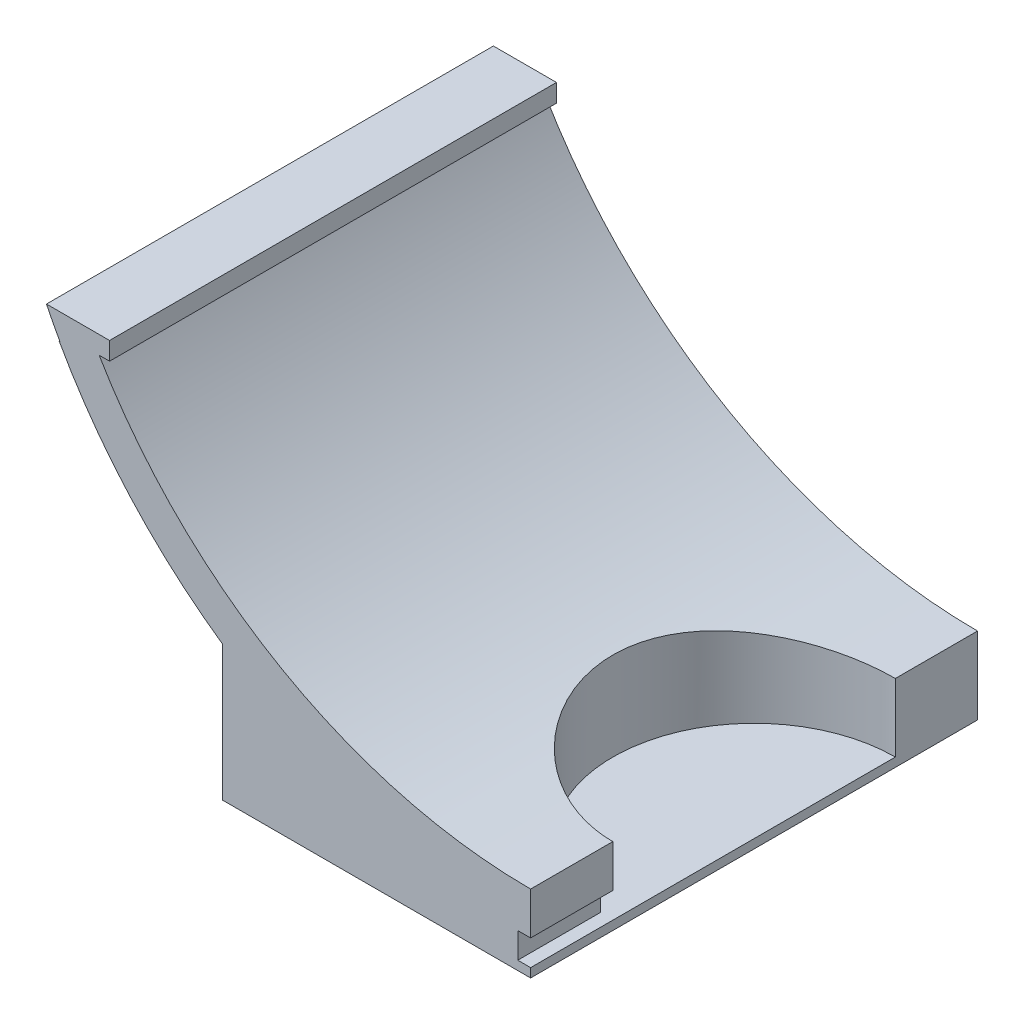
from build123d import *

# Parameters (mm, degrees)
SKETCH_1_R          = 210
SKETCH_1_R_2        = 203
EXTRUDE_2_DEPTH     = 174
EXTRUDE_START       = -174
EXTRUDE_4_DEPTH     = 174
CUT_EXTRUDE_1_DEPTH = 654
EXTRUDE_5_DEPTH     = 174
EXTRUDE_6_DEPTH     = 174
EXTRUDE_7_DEPTH     = 174
EXTRUDE_8_DEPTH     = 174
EXTRUDE_9_DEPTH     = 174
SKETCH_11_R         = 55
CUT_EXTRUDE_4_DEPTH = 221.5
CUT_EXTRUDE_5_DEPTH = 87
SKETCH_12_W         = 668.295244713
SKETCH_12_H         = 385.154580286
CUT_EXTRUDE_6_DEPTH = 280


with BuildPart() as part:
    # 草图1 → 凸台-拉伸2 (new body)
    with BuildSketch(Plane.XY):
        Circle(SKETCH_1_R)
        Circle(SKETCH_1_R_2, mode=Mode.SUBTRACT)
    extrude(amount=EXTRUDE_2_DEPTH)

    # 草图2 → 凸台-拉伸4 (add)
    with BuildSketch(Plane.XY.offset(174).offset(EXTRUDE_START)):
        with BuildLine():
            Line((-170.735431044, -102), (-173.735431044, -102))
            Line((-173.735431044, -102), (-175.513532242, -102))
            ThreePointArc((-175.513532242, -102), (-174.63092392, -103.50381834), (-173.735431044, -105))
            Line((-173.735431044, -105), (-170.735431044, -105))
            Line((-170.735431044, -105), (-170.735431044, -102))
        make_face()
        with BuildLine():
            ThreePointArc((173.735431044, -105), (174.63092392, -103.50381834), (175.513532242, -102))
            Line((175.513532242, -102), (173.735431044, -102))
            Line((173.735431044, -102), (170.735431044, -102))
            Line((170.735431044, -102), (170.735431044, -105))
            Line((170.735431044, -105), (173.735431044, -105))
        make_face()
    extrude(amount=EXTRUDE_4_DEPTH)

    # 草图3 → 切除-拉伸1 (cut)
    with BuildSketch(Plane.XY.offset(174)):
        Polygon((-170.735431044, -102), (238.333646515, -102), (254.334169784, 272.292523591), (-334.569415043, 221.85110305), (-306.830562533, -102), align=None)
    extrude(amount=-CUT_EXTRUDE_1_DEPTH, mode=Mode.SUBTRACT)

    # 草图5 → 凸台-拉伸5 (add)
    with BuildSketch(Plane.XY.offset(174).offset(EXTRUDE_START)):
        with BuildLine():
            Line((-120, -209.75), (-10.243900624, -209.75))
            ThreePointArc((-10.243900624, -209.75), (-67.755470707, -198.769203322), (-120, -172.336879396))
            Line((-120, -172.336879396), (-120, -209.75))
        make_face()
        with BuildLine():
            ThreePointArc((120, -172.336879396), (67.755470707, -198.769203322), (10.243900624, -209.75))
            Line((10.243900624, -209.75), (120, -209.75))
            Line((120, -209.75), (120, -172.336879396))
        make_face()
    extrude(amount=EXTRUDE_5_DEPTH)

    # 草图6 → 凸台-拉伸6 (add)
    with BuildSketch(Plane.XY.offset(174).offset(EXTRUDE_START)):
        with BuildLine():
            Line((-175.513532242, -102), (-166.195667814, -102))
            ThreePointArc((-166.195667814, -102), (0, -195), (166.195667814, -102))
            Line((166.195667814, -102), (175.513532242, -102))
            ThreePointArc((175.513532242, -102), (0, -203), (-175.513532242, -102))
        make_face()
    extrude(amount=EXTRUDE_6_DEPTH)

    # 草图7 → 凸台-拉伸7 (add)
    with BuildSketch(Plane.XY.offset(174).offset(EXTRUDE_START)):
        with BuildLine():
            Line((-166.933126535, -92), (-166.933126535, -95))
            Line((-166.933126535, -95), (-170.293863659, -95))
            ThreePointArc((-170.293863659, -95), (0, -195), (170.293863659, -95))
            Line((170.293863659, -95), (166.933126535, -95))
            Line((166.933126535, -95), (166.933126535, -92))
            Line((166.933126535, -92), (171.933126535, -92))
            Line((171.933126535, -92), (188.496850106, -92))
            ThreePointArc((188.496850106, -92), (0, -209.75), (-188.496850106, -92))
            Line((-188.496850106, -92), (-171.933126535, -92))
            Line((-171.933126535, -92), (-166.933126535, -92))
        make_face()
    extrude(amount=EXTRUDE_7_DEPTH)

    # 草图8 → 凸台-拉伸8 (add)
    with BuildSketch(Plane(origin=(0, 0, 0), x_dir=(-1, 0, 0), z_dir=(0, 0, -1))):
        with BuildLine():
            Line((166.933126535, -92), (163.933126535, -92))
            Line((163.933126535, -92), (163.933126535, -99))
            Line((163.933126535, -99), (168, -99))
            ThreePointArc((168, -99), (169.158755456, -97.006780447), (170.293863659, -95))
            Line((170.293863659, -95), (166.933126535, -95))
            Line((166.933126535, -95), (166.933126535, -92))
        make_face()
        with BuildLine():
            Line((-166.933126535, -95), (-170.293863659, -95))
            ThreePointArc((-170.293863659, -95), (-169.158755456, -97.006780447), (-168, -99))
            Line((-168, -99), (-163.933126535, -99))
            Line((-163.933126535, -99), (-163.933126535, -92))
            Line((-163.933126535, -92), (-166.933126535, -92))
            Line((-166.933126535, -92), (-166.933126535, -95))
        make_face()
    extrude(amount=-EXTRUDE_8_DEPTH)

    # 草图9 → 凸台-拉伸9 (add)
    with BuildSketch(Plane.XY.offset(174).offset(EXTRUDE_START)):
        with BuildLine():
            ThreePointArc((10.243900624, -209.75), (5.123475383, -209.937490697), (0, -210))
            Line((0, -210), (0, -225))
            Line((0, -225), (18.007375678, -225))
            Line((18.007375678, -225), (120, -225))
            Line((120, -225), (120, -209.75))
            Line((120, -209.75), (10.243900624, -209.75))
        make_face()
        with BuildLine():
            Line((0, -225), (0, -210))
            ThreePointArc((0, -210), (-5.123475383, -209.937490697), (-10.243900624, -209.75))
            Line((-10.243900624, -209.75), (-120, -209.75))
            Line((-120, -209.75), (-120, -225))
            Line((-120, -225), (0, -225))
        make_face()
    extrude(amount=EXTRUDE_9_DEPTH)

    # 草图11 → 切除-拉伸4 (cut)
    with BuildSketch(Plane(origin=(0, 0, 0), x_dir=(1, 0, 0), z_dir=(0, 1, 0))):
        with Locations(Location((0, -87, 0), (0, 0, 270))):
            Circle(SKETCH_11_R)
    extrude(amount=-CUT_EXTRUDE_4_DEPTH, mode=Mode.SUBTRACT)

    # 草图10 → 切除-拉伸5 (cut)
    with BuildSketch(Plane.XY.offset(174)):
        Polygon((5, -221.5), (-5, -221.5), (-5, -211.5), (0, -211.5), (5, -211.5), align=None)
    extrude(amount=-CUT_EXTRUDE_5_DEPTH, mode=Mode.SUBTRACT)

    # 草图12 → 切除-拉伸6 (cut)
    with BuildSketch(Plane(origin=(0, 0, 0), x_dir=(0, 0, -1), z_dir=(1, 0, 0))):
        with Locations((66.714846006, -68.457104879)):
            Rectangle(SKETCH_12_W, SKETCH_12_H)
    extrude(amount=CUT_EXTRUDE_6_DEPTH, mode=Mode.SUBTRACT)


solid = part.part
